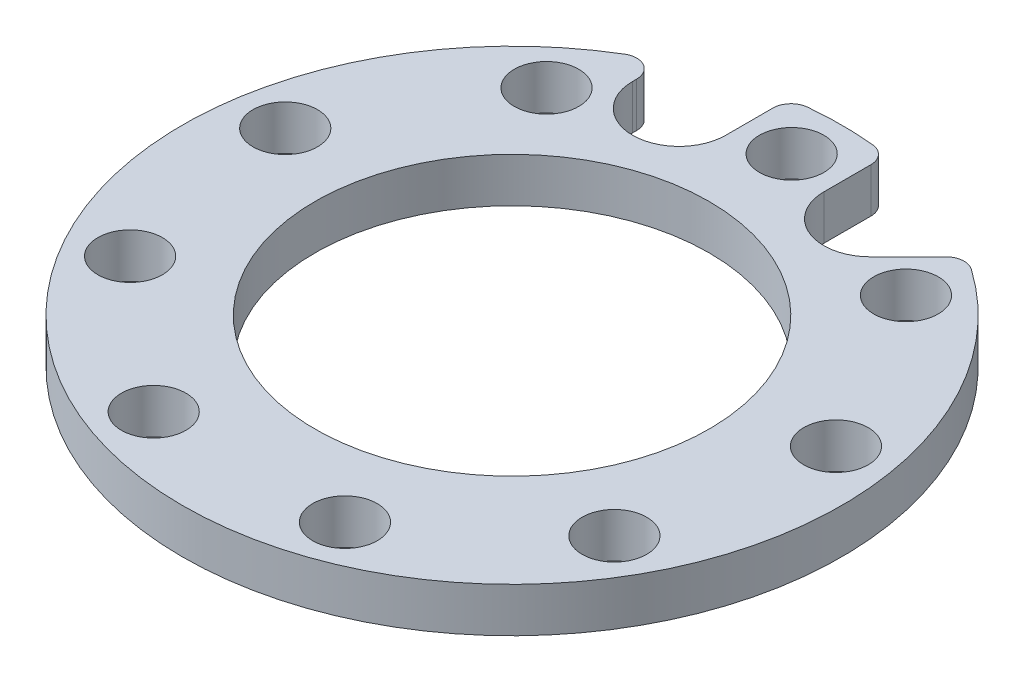
from build123d import *

# Parameters (mm, degrees)
SKETCH1_R            = 45.974
SKETCH1_R_2          = 27.4955
SKETCH1_R_3          = 6.5
BOSS_EXTRUDE1_DEPTH  = 6.21400078
M8_CLEARANCE_HOLE1_D = 9
CIRPATTERN1_COUNT    = 9
CUT_EXTRUDE1_DEPTH   = 66.313330628
FILLET1_R            = 2.54


with BuildPart() as part:
    # Sketch1 → Boss-Extrude1 (new body)
    with BuildSketch(Plane(origin=(0, 0, 0), x_dir=(1, 0, 0), z_dir=(0, 1, 0))):
        with Locations(Location((0, 0, 0), (0, 0, 90))):
            Circle(SKETCH1_R)
        with Locations(Location((0, 0, 0), (0, 0, 90))):
            Circle(SKETCH1_R_2, mode=Mode.SUBTRACT)
        with Locations(Location((-13.33878559, 36.648012211, 0), (0, 0, 90))):
            Circle(SKETCH1_R_3, mode=Mode.SUBTRACT)
        with Locations(Location((13.33878559, 36.648012211, 0), (0, 0, 90))):
            Circle(SKETCH1_R_3, mode=Mode.SUBTRACT)
    extrude(amount=BOSS_EXTRUDE1_DEPTH)

    # M8 Clearance Hole1 (through all)
    with Locations(Plane(origin=(0, 6.21400078, 0), x_dir=(1, 0, 0), z_dir=(0, 1, 0))):
        with Locations((0, 39)):
            m8_clearance_hole1 = Hole(M8_CLEARANCE_HOLE1_D / 2)

    # CirPattern1: M8 Clearance Hole1 ×9 about axis
    cirpattern1_axis = Axis((0, 0, 0), (0, 1, 0))
    for i in range(1, CIRPATTERN1_COUNT):
        add(m8_clearance_hole1.rotate(cirpattern1_axis, i * 360 / CIRPATTERN1_COUNT), mode=Mode.SUBTRACT)

    # Sketch6 → Cut-Extrude1 (cut, through all)
    with BuildSketch(Plane(origin=(0, 6.21400078, 0), x_dir=(1, 0, 0), z_dir=(0, 1, 0))):
        with BuildLine():
            Line((17.934979667, 32.051818133), (24.674577095, 38.79141556))
            ThreePointArc((24.674577095, 38.79141556), (16.105864692, 43.06053644), (6.83878559, 45.462508594))
            Line((6.83878559, 45.462508594), (6.83878559, 36.648012211))
            ThreePointArc((6.83878559, 36.648012211), (15.8262279, 42.653229172), (17.934979667, 32.051818133))
        make_face()
        with BuildLine():
            Line((-6.83878559, 36.648012211), (-6.83878559, 45.462508594))
            ThreePointArc((-6.83878559, 45.462508594), (-13.487094864, 43.951188245), (-19.83878559, 41.473259606))
            Line((-19.83878559, 41.473259606), (-19.83878559, 36.648012211))
            ThreePointArc((-19.83878559, 36.648012211), (-13.33878559, 43.148012211), (-6.83878559, 36.648012211))
        make_face()
    extrude(amount=-CUT_EXTRUDE1_DEPTH, mode=Mode.SUBTRACT)

    # Fillet1
    fillet1_edges = [part.edges().sort_by_distance(p)[0] for p in [
        (6.83878559, 3.10700039, -45.462508594),
        (24.674577095, 3.10700039, -38.79141556),
        (-19.83878559, 3.10700039, -41.473259606),
        (-6.83878559, 3.10700039, -45.462508594),
    ]]
    fillet(fillet1_edges, radius=FILLET1_R)


solid = part.part
